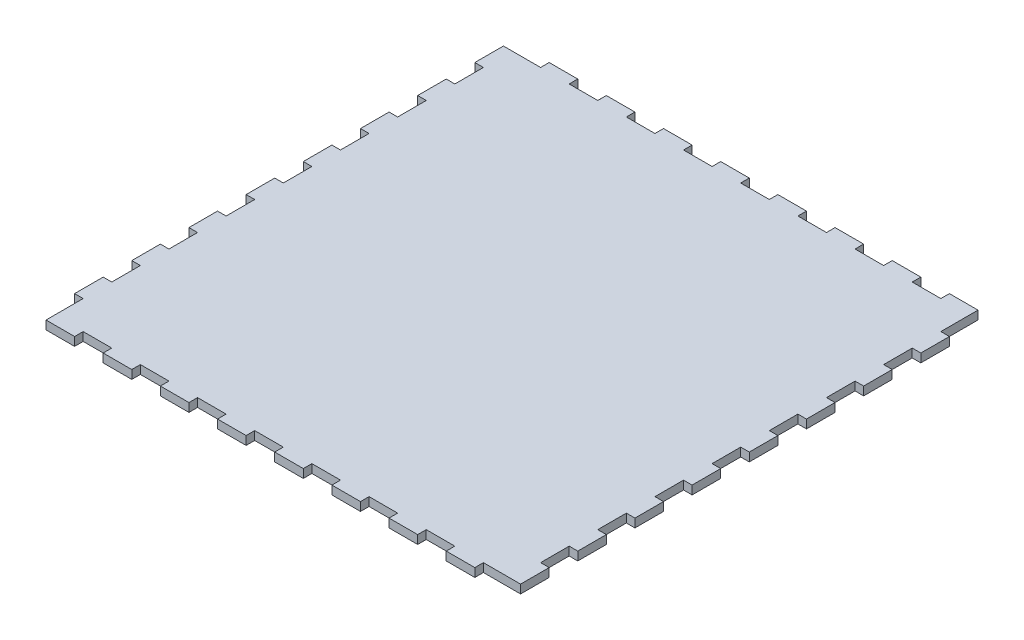
from build123d import *

# Parameters (mm, degrees)
BOSS_EXTRUDE1_DEPTH = 3


with BuildPart() as part:
    # Sketch1 → Boss-Extrude1 (new body)
    with BuildSketch(Plane(origin=(0, 0, 0), x_dir=(1, 0, 0), z_dir=(0, 1, 0))):
        Polygon((80, 80), (80, 70), (83, 70), (83, 60), (80, 60), (80, 50), (83, 50), (83, 40), (80, 40), (80, 30), (83, 30), (83, 20), (80, 20), (80, 10), (83, 10), (83, 0), (80, 0), (80, -10), (83, -10), (83, -20), (80, -20), (80, -30), (83, -30), (83, -40), (80, -40), (80, -50), (83, -50), (83, -60), (80, -60), (80, -70), (83, -70), (83, -80), (80, -80), (70, -80), (70, -83), (60, -83), (60, -80), (50, -80), (50, -83), (40, -83), (40, -80), (30, -80), (30, -83), (20, -83), (20, -80), (10, -80), (10, -83), (0, -83), (0, -80), (-10, -80), (-10, -83), (-20, -83), (-20, -80), (-30, -80), (-30, -83), (-40, -83), (-40, -80), (-50, -80), (-50, -83), (-60, -83), (-60, -80), (-70, -80), (-70, -83), (-80, -83), (-80, -80), (-80, -70), (-83, -70), (-83, -60), (-80, -60), (-80, -50), (-83, -50), (-83, -40), (-80, -40), (-80, -30), (-83, -30), (-83, -20), (-80, -20), (-80, -10), (-83, -10), (-83, 0), (-80, 0), (-80, 10), (-83, 10), (-83, 20), (-80, 20), (-80, 30), (-83, 30), (-83, 40), (-80, 40), (-80, 50), (-83, 50), (-83, 60), (-80, 60), (-80, 70), (-83, 70), (-83, 80), (-80, 80), (-70, 80), (-70, 83), (-60, 83), (-60, 80), (-50, 80), (-50, 83), (-40, 83), (-40, 80), (-30, 80), (-30, 83), (-20, 83), (-20, 80), (-10, 80), (-10, 83), (0, 83), (0, 80), (10, 80), (10, 83), (20, 83), (20, 80), (30, 80), (30, 83), (40, 83), (40, 80), (50, 80), (50, 83), (60, 83), (60, 80), (70, 80), (70, 83), (80, 83), align=None)
    extrude(amount=BOSS_EXTRUDE1_DEPTH)


solid = part.part
